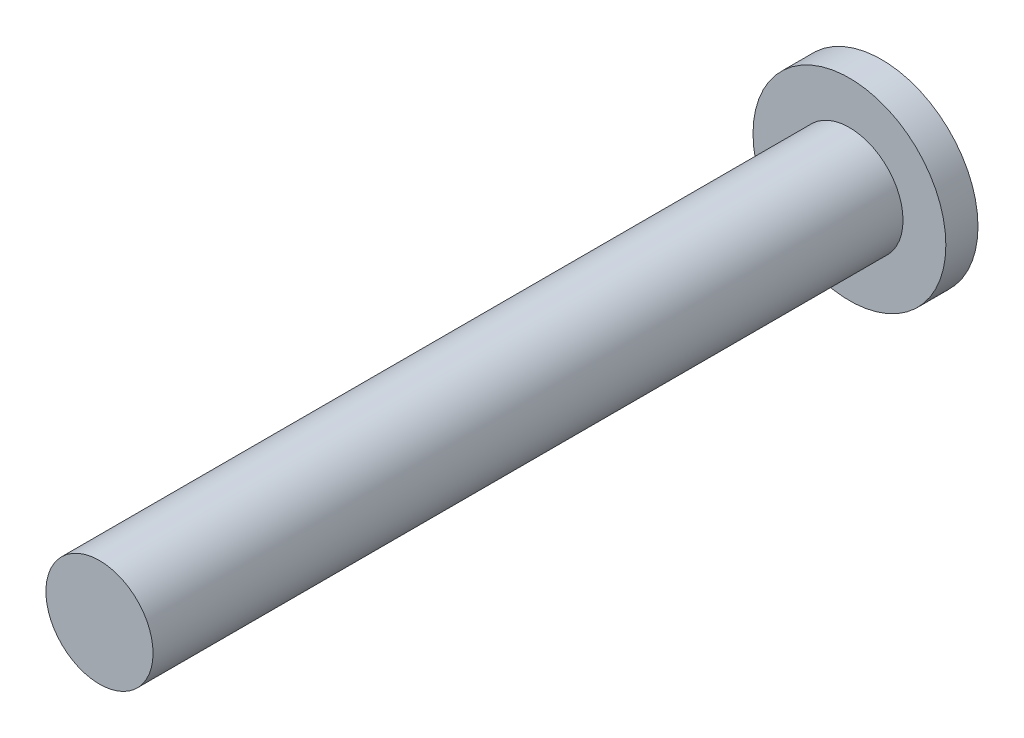
from build123d import *

# Parameters (mm, degrees)
SKETCH1_R           = 4.5
BOSS_EXTRUDE1_DEPTH = 1.5
SKETCH1_3_R         = 2.5
BOSS_EXTRUDE2_DEPTH = 35


with BuildPart() as part:
    # Sketch1 → Boss-Extrude1 (new body)
    with BuildSketch(Plane.XY):
        Circle(SKETCH1_R)
    extrude(amount=-BOSS_EXTRUDE1_DEPTH)

    # Sketch1<3> → Boss-Extrude2 (add)
    with BuildSketch(Plane.XY):
        Circle(SKETCH1_3_R)
    extrude(amount=BOSS_EXTRUDE2_DEPTH)


solid = part.part
